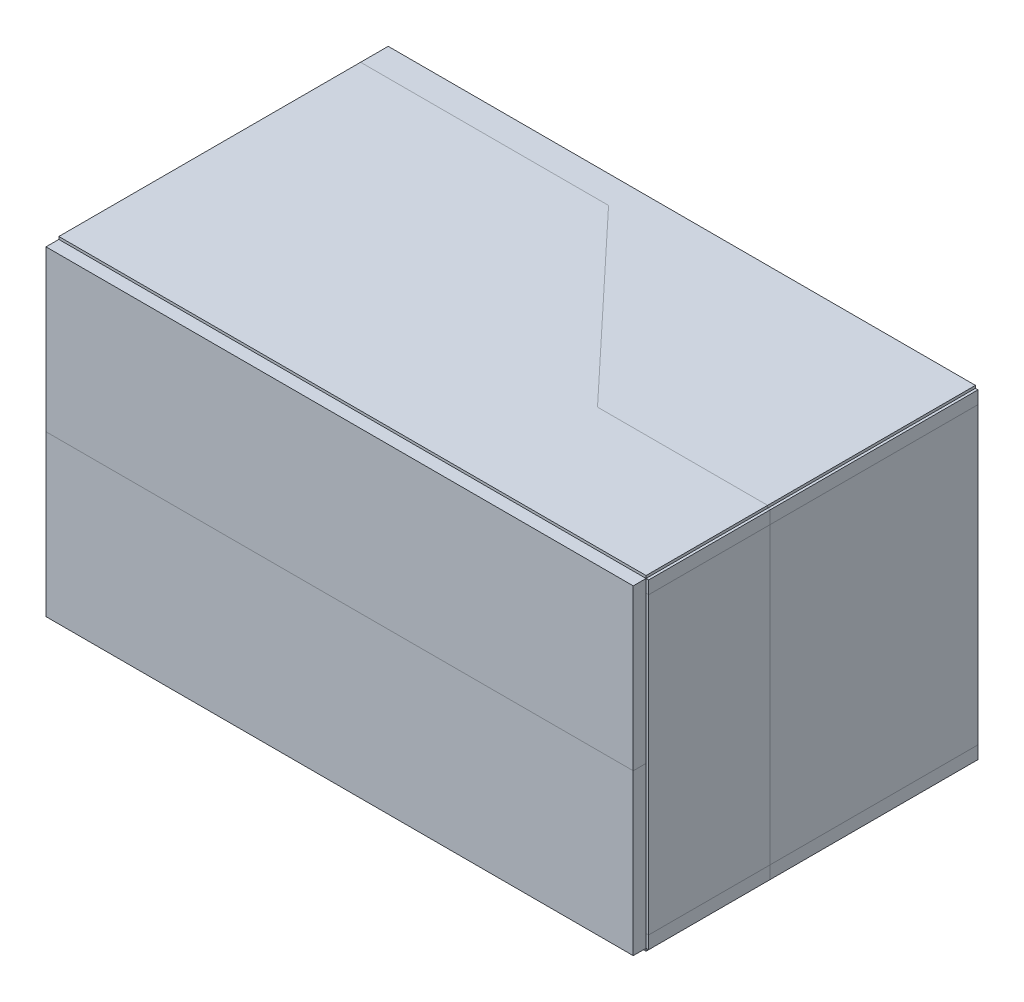
from build123d import *

# Parameters (mm, degrees)
SKETCH_1_W          = 229
SKETCH_1_H          = 124.895981316
EXTRUDE_1_DEPTH     = 7.860636733
SKETCH_2_W          = 229
SKETCH_2_H          = 5
CUT_EXTRUDE_1_DEPTH = 7.860636733
SKETCH_4_W          = 229
SKETCH_4_H          = 5
CUT_EXTRUDE_2_DEPTH = 7.860636733
SKETCH_5_W          = 5
SKETCH_5_H          = 114.895981316
CUT_EXTRUDE_3_DEPTH = 7.860636733
SKETCH_6_W          = 229
SKETCH_6_H          = 128.442125646
EXTRUDE_3_DEPTH     = 5
SKETCH_7_W          = 5
SKETCH_7_H          = 114.895981316
EXTRUDE_4_DEPTH     = 120.581488912
SKETCH_8_W          = 229
SKETCH_8_H          = 128.442125646
EXTRUDE_5_DEPTH     = 5
SKETCH_9_W          = 229
SKETCH_9_H          = 62.45
EXTRUDE_6_DEPTH     = 5
SKETCH_10_W         = 229
SKETCH_10_H         = 62.445981316
EXTRUDE_7_DEPTH     = 5
SKETCH_11_W         = 128.442125646
SKETCH_11_H         = 114.895981316
EXTRUDE_8_DEPTH     = 5
EXTRUDE_9_DEPTH     = 1
EXTRUDE_10_DEPTH    = 1
SKETCH_14_W         = 47.406489423
SKETCH_14_H         = 5
EXTRUDE_11_DEPTH    = 1
SKETCH_15_W         = 81.035636223
SKETCH_15_H         = 5
EXTRUDE_12_DEPTH    = 1
SKETCH_16_W         = 47.406489423
SKETCH_16_H         = 114.895981316
EXTRUDE_13_DEPTH    = 1
SKETCH_17_W         = 81.035636223
SKETCH_17_H         = 114.895981316
EXTRUDE_14_DEPTH    = 1
SKETCH_18_W         = 53.126978482
SKETCH_18_H         = 23.043618666
EXTRUDE_15_DEPTH    = 20
SKETCH_18_W_2       = 40.390239825
EXTRUDE_15_2_DEPTH  = 20
SKETCH_18_W_3       = 34.059537502
EXTRUDE_15_3_DEPTH  = 20
SKETCH_18_W_4       = 41.132707469
EXTRUDE_15_4_DEPTH  = 20
SKETCH_18_W_5       = 34.565287386
SKETCH_18_H_2       = 26.831202025
EXTRUDE_15_5_DEPTH  = 20
SKETCH_18_W_6       = 31.183641042
EXTRUDE_15_6_DEPTH  = 20
SKETCH_18_W_7       = 48.408890379
SKETCH_18_H_3       = 42.023668641
EXTRUDE_15_7_DEPTH  = 20
SKETCH_18_W_8       = 10.097559957
SKETCH_18_H_4       = 12.02797583
EXTRUDE_15_8_DEPTH  = 20
SKETCH_18_W_9       = 56.72452799
SKETCH_18_H_5       = 25.837874006
EXTRUDE_15_9_DEPTH  = 20
SKETCH_18_W_10      = 70.946201934
SKETCH_18_H_6       = 24.501432247
EXTRUDE_15_10_DEPTH = 20
SKETCH_18_W_11      = 64.297697957
SKETCH_18_H_7       = 26.728835178
EXTRUDE_15_11_DEPTH = 20
SKETCH_18_W_12      = 75.583206143
SKETCH_18_H_8       = 13.809898175
EXTRUDE_15_12_DEPTH = 20
SKETCH_18_W_13      = 64.000710899
SKETCH_18_H_9       = 34.302005145
EXTRUDE_15_13_DEPTH = 20
SKETCH_18_W_14      = 22.868003431
SKETCH_18_H_10      = 13.661404647
EXTRUDE_15_14_DEPTH = 20
SKETCH_18_W_15      = 24.204445189
SKETCH_18_H_11      = 11.582495244
EXTRUDE_15_15_DEPTH = 20
SKETCH_19_W         = 41.559774858
SKETCH_19_H         = 32.537902024
EXTRUDE_16_DEPTH    = 20
SKETCH_19_W_2       = 56.053931213
SKETCH_19_H_2       = 25.586622955
EXTRUDE_16_2_DEPTH  = 20
SKETCH_19_W_3       = 20.705937651
SKETCH_19_H_3       = 41.559774857
EXTRUDE_16_3_DEPTH  = 20
SKETCH_19_W_4       = 47.52357196
SKETCH_19_H_4       = 34.164797125
EXTRUDE_16_4_DEPTH  = 20
SKETCH_19_W_5       = 66.702699149
SKETCH_19_H_5       = 32.833701134
EXTRUDE_16_5_DEPTH  = 20
SKETCH_19_W_6       = 41.116076194
SKETCH_19_H_6       = 47.179957935
EXTRUDE_16_6_DEPTH  = 20
SKETCH_19_W_7       = 56.941328542
SKETCH_19_H_7       = 53.983337449
EXTRUDE_16_7_DEPTH  = 20
SKETCH_19_W_8       = 68.62539336
SKETCH_19_H_8       = 26.962014566
EXTRUDE_16_8_DEPTH  = 20
SKETCH_20_W         = 45.290526275
SKETCH_20_H         = 45.142032745
EXTRUDE_17_DEPTH    = 30
SKETCH_20_W_2       = 59.545905036
SKETCH_20_H_2       = 52.269722127
EXTRUDE_17_2_DEPTH  = 30
SKETCH_20_W_3       = 54.497125058
SKETCH_20_H_3       = 28.065276937
EXTRUDE_17_3_DEPTH  = 30
SKETCH_20_W_4       = 23.164990488
SKETCH_20_H_4       = 57.466995634
EXTRUDE_17_4_DEPTH  = 30
SKETCH_20_W_5       = 55.833566817
SKETCH_20_H_5       = 37.42036925
EXTRUDE_17_5_DEPTH  = 30
SKETCH_20_W_6       = 53.754657414
SKETCH_20_H_6       = 43.508603929
EXTRUDE_17_6_DEPTH  = 30
SKETCH_20_W_7       = 19.898132855
SKETCH_20_H_7       = 64.297697957
EXTRUDE_17_7_DEPTH  = 30
SKETCH_20_W_8       = 23.758964603
SKETCH_20_H_8       = 62.664269141
EXTRUDE_17_8_DEPTH  = 30
SKETCH_20_W_9       = 29.550212225
SKETCH_20_H_9       = 31.33213457
EXTRUDE_17_9_DEPTH  = 30
SKETCH_21_W         = 24.501432247
SKETCH_21_H         = 25.837874006
EXTRUDE_18_DEPTH    = 30
SKETCH_21_W_2       = 35.638446905
SKETCH_21_H_2       = 33.559537501
EXTRUDE_18_2_DEPTH  = 30
SKETCH_21_W_3       = 43.211616871
SKETCH_21_H_3       = 31.035147513
EXTRUDE_18_3_DEPTH  = 30
SKETCH_21_W_4       = 40.835720412
SKETCH_21_H_4       = 43.063123343
EXTRUDE_18_4_DEPTH  = 30
SKETCH_21_W_5       = 47.07244862
SKETCH_21_H_5       = 20.195119913
EXTRUDE_18_5_DEPTH  = 30
SKETCH_21_W_6       = 38.756811008
SKETCH_21_H_6       = 46.775461563
EXTRUDE_18_6_DEPTH  = 30
SKETCH_21_W_7       = 55.982060345
SKETCH_21_H_7       = 32.520082801
EXTRUDE_18_7_DEPTH  = 30
SKETCH_22_W         = 20
SKETCH_22_H         = 80
EXTRUDE_19_DEPTH    = 20
FILLET_1_R          = 10
SKETCH_23_W         = 2
SKETCH_23_H         = 70
CUT_EXTRUDE_4_DEPTH = 15


with BuildPart() as part:
    # 스케치1 → 보스-돌출1 (new body)
    with BuildSketch(Plane.XY):
        with Locations((165.5, 12.447990658)):
            Rectangle(SKETCH_1_W, SKETCH_1_H)
    extrude(amount=EXTRUDE_1_DEPTH)

    # 스케치2 → 컷-돌출1 (cut)
    with BuildSketch(Plane.XY.offset(7.860636733)):
        with Locations((165.5, 72.395981316)):
            Rectangle(SKETCH_2_W, SKETCH_2_H)
    extrude(amount=-CUT_EXTRUDE_1_DEPTH, mode=Mode.SUBTRACT)

    # 스케치4 → 컷-돌출2 (cut)
    with BuildSketch(Plane.XY.offset(7.860636733)):
        with Locations((165.5, -47.5)):
            Rectangle(SKETCH_4_W, SKETCH_4_H)
    extrude(amount=-CUT_EXTRUDE_2_DEPTH, mode=Mode.SUBTRACT)

    # 스케치5 → 컷-돌출3 (cut)
    with BuildSketch(Plane.XY.offset(7.860636733)):
        with Locations((277.5, 12.447990658)):
            Rectangle(SKETCH_5_W, SKETCH_5_H)
    extrude(amount=-CUT_EXTRUDE_3_DEPTH, mode=Mode.SUBTRACT)


with BuildPart() as body_2:
    # 스케치6 → 보스-돌출3 (new body)
    with BuildSketch(Plane(origin=(0, 69.895981316, 0), x_dir=(1, 0, 0), z_dir=(0, 1, 0))):
        with Locations((165.5, -64.221062823)):
            Rectangle(SKETCH_6_W, SKETCH_6_H)
    extrude(amount=EXTRUDE_3_DEPTH)


with BuildPart() as body_3:
    # 스케치7 → 보스-돌출4 (new body)
    with BuildSketch(Plane.XY.offset(7.860636733)):
        with Locations((53.5, 12.447990658)):
            Rectangle(SKETCH_7_W, SKETCH_7_H)
    extrude(amount=EXTRUDE_4_DEPTH)


with BuildPart() as body_4:
    # 스케치8 → 보스-돌출5 (new body)
    with BuildSketch(Plane.XZ.offset(45)):
        with Locations((165.5, 64.221062823)):
            Rectangle(SKETCH_8_W, SKETCH_8_H)
    extrude(amount=EXTRUDE_5_DEPTH)


with BuildPart() as body_5:
    # 스케치9 → 보스-돌출6 (new body)
    with BuildSketch(Plane.XY.offset(128.442125646)):
        with Locations((165.5, 43.670981316)):
            Rectangle(SKETCH_9_W, SKETCH_9_H)
    extrude(amount=EXTRUDE_6_DEPTH)


with BuildPart() as body_6:
    # 스케치10 → 보스-돌출7 (new body)
    with BuildSketch(Plane.XY.offset(128.442125646)):
        with Locations((165.5, -18.777009342)):
            Rectangle(SKETCH_10_W, SKETCH_10_H)
    extrude(amount=EXTRUDE_7_DEPTH)


with BuildPart() as body_7:
    # 스케치11 → 보스-돌출8 (new body)
    with BuildSketch(Plane(origin=(275, 0, 0), x_dir=(0, 0, -1), z_dir=(1, 0, 0))):
        with Locations((-64.221062823, 12.447990658)):
            Rectangle(SKETCH_11_W, SKETCH_11_H)
    extrude(amount=EXTRUDE_8_DEPTH)


with BuildPart() as body_8:
    # 스케치12 → 보스-돌출9 (new body)
    with BuildSketch(Plane.XZ.offset(50)):
        Polygon((51, 10.771238208), (147.705868367, 10.771238208), (213.658520424, 81.035636223), (280, 81.035636223), (280, 0), (51, 0), align=None)
    extrude(amount=EXTRUDE_9_DEPTH)


with BuildPart() as body_9:
    # 스케치13 → 보스-돌출10 (new body)
    with BuildSketch(Plane.XZ.offset(50)):
        Polygon((51, 128.442125646), (51, 10.771238208), (147.705868367, 10.771238208), (213.658520424, 81.035636223), (280, 81.035636223), (280, 128.442125646), align=None)
    extrude(amount=EXTRUDE_10_DEPTH)


with BuildPart() as body_10:
    # 스케치14 → 보스-돌출11 (new body)
    with BuildSketch(Plane(origin=(280, 0, 0), x_dir=(0, 0, -1), z_dir=(1, 0, 0))):
        with Locations((-104.738880935, -47.5)):
            Rectangle(SKETCH_14_W, SKETCH_14_H)
    extrude(amount=EXTRUDE_11_DEPTH)


with BuildPart() as body_11:
    # 스케치15 → 보스-돌출12 (new body)
    with BuildSketch(Plane(origin=(280, 0, 0), x_dir=(0, 0, -1), z_dir=(1, 0, 0))):
        with Locations((-40.517818112, -47.5)):
            Rectangle(SKETCH_15_W, SKETCH_15_H)
    extrude(amount=EXTRUDE_12_DEPTH)


with BuildPart() as body_12:
    # 스케치16 → 보스-돌출13 (new body)
    with BuildSketch(Plane(origin=(280, 0, 0), x_dir=(0, 0, -1), z_dir=(1, 0, 0))):
        with Locations((-104.738880935, 12.447990658)):
            Rectangle(SKETCH_16_W, SKETCH_16_H)
    extrude(amount=EXTRUDE_13_DEPTH)


with BuildPart() as body_13:
    # 스케치17 → 보스-돌출14 (new body)
    with BuildSketch(Plane(origin=(280, 0, 0), x_dir=(0, 0, -1), z_dir=(1, 0, 0))):
        with Locations((-40.517818112, 12.447990658)):
            Rectangle(SKETCH_17_W, SKETCH_17_H)
    extrude(amount=EXTRUDE_14_DEPTH)


with BuildPart() as body_14:
    # 대칭 복사2: mirrored copy
    add(body_8.part.mirror(Plane.ZX.offset(12.445981316)))


with BuildPart() as body_15:
    # Mirror 2 2: mirrored copy
    add(body_9.part.mirror(Plane.ZX.offset(12.445981316)))


with BuildPart() as body_16:
    # Mirror 2 3: mirrored copy
    add(body_10.part.mirror(Plane.ZX.offset(12.445981316)))


with BuildPart() as body_17:
    # Mirror 2 4: mirrored copy
    add(body_11.part.mirror(Plane.ZX.offset(12.445981316)))


with BuildPart() as body_18:
    # 스케치18 → 보스-돌출15 (new body)
    with BuildSketch(Plane.XY.offset(7.860636733)):
        with Locations((82.563489241, 58.374171983)):
            Rectangle(SKETCH_18_W, SKETCH_18_H)
    extrude(amount=EXTRUDE_15_DEPTH)


with BuildPart() as body_19:
    # 스케치18 → Extrude 15 2 (new body)
    with BuildSketch(Plane.XY.offset(7.860636733)):
        with Locations((138.23171012, 58.374171983)):
            Rectangle(SKETCH_18_W_2, SKETCH_18_H)
    extrude(amount=EXTRUDE_15_2_DEPTH)


with BuildPart() as body_20:
    # 스케치18 → Extrude 15 3 (new body)
    with BuildSketch(Plane.XY.offset(7.860636733)):
        with Locations((182.529768751, 58.374171983)):
            Rectangle(SKETCH_18_W_3, SKETCH_18_H)
    extrude(amount=EXTRUDE_15_3_DEPTH)


with BuildPart() as body_21:
    # 스케치18 → Extrude 15 4 (new body)
    with BuildSketch(Plane.XY.offset(7.860636733)):
        with Locations((227.402074146, 58.374171983)):
            Rectangle(SKETCH_18_W_4, SKETCH_18_H)
    extrude(amount=EXTRUDE_15_4_DEPTH)


with BuildPart() as body_22:
    # 스케치18 → Extrude 15 5 (new body)
    with BuildSketch(Plane.XY.offset(7.860636733)):
        with Locations((73.282643693, 25.863591671)):
            Rectangle(SKETCH_18_W_5, SKETCH_18_H_2)
    extrude(amount=EXTRUDE_15_5_DEPTH)


with BuildPart() as body_23:
    # 스케치18 → Extrude 15 6 (new body)
    with BuildSketch(Plane.XY.offset(7.860636733)):
        with Locations((111.354381413, 25.863591671)):
            Rectangle(SKETCH_18_W_6, SKETCH_18_H_2)
    extrude(amount=EXTRUDE_15_6_DEPTH)


with BuildPart() as body_24:
    # 스케치18 → Extrude 15 7 (new body)
    with BuildSketch(Plane.XY.offset(7.860636733)):
        with Locations((160.06025885, 18.267358363)):
            Rectangle(SKETCH_18_W_7, SKETCH_18_H_3)
    extrude(amount=EXTRUDE_15_7_DEPTH)


with BuildPart() as body_25:
    # 스케치18 → Extrude 15 8 (new body)
    with BuildSketch(Plane.XY.offset(7.860636733)):
        with Locations((194.510757524, 33.265204768)):
            Rectangle(SKETCH_18_W_8, SKETCH_18_H_4)
    extrude(amount=EXTRUDE_15_8_DEPTH)


with BuildPart() as body_26:
    # 스케치18 → Extrude 15 9 (new body)
    with BuildSketch(Plane.XY.offset(7.860636733)):
        with Locations((235.197984406, 26.36025568)):
            Rectangle(SKETCH_18_W_9, SKETCH_18_H_5)
    extrude(amount=EXTRUDE_15_9_DEPTH)


with BuildPart() as body_27:
    # 스케치18 → Extrude 15 10 (new body)
    with BuildSketch(Plane.XY.offset(7.860636733)):
        with Locations((91.473100967, -8.312983287)):
            Rectangle(SKETCH_18_W_10, SKETCH_18_H_6)
    extrude(amount=EXTRUDE_15_10_DEPTH)


with BuildPart() as body_28:
    # 스케치18 → Extrude 15 11 (new body)
    with BuildSketch(Plane.XY.offset(7.860636733)):
        with Locations((162.361908546, -18.484790008)):
            Rectangle(SKETCH_18_W_11, SKETCH_18_H_7)
    extrude(amount=EXTRUDE_15_11_DEPTH)


with BuildPart() as body_29:
    # 스케치18 → Extrude 15 12 (new body)
    with BuildSketch(Plane.XY.offset(7.860636733)):
        with Locations((225.76864533, 4.160473129)):
            Rectangle(SKETCH_18_W_12, SKETCH_18_H_8)
    extrude(amount=EXTRUDE_15_12_DEPTH)


with BuildPart() as body_30:
    # 스케치18 → Extrude 15 13 (new body)
    with BuildSketch(Plane.XY.offset(7.860636733)):
        with Locations((231.559892952, -24.350284395)):
            Rectangle(SKETCH_18_W_13, SKETCH_18_H_9)
    extrude(amount=EXTRUDE_15_13_DEPTH)


with BuildPart() as body_31:
    # 스케치18 → Extrude 15 14 (new body)
    with BuildSketch(Plane.XY.offset(7.860636733)):
        with Locations((70.073180416, -34.670584644)):
            Rectangle(SKETCH_18_W_14, SKETCH_18_H_10)
    extrude(amount=EXTRUDE_15_14_DEPTH)


with BuildPart() as body_32:
    # 스케치18 → Extrude 15 15 (new body)
    with BuildSketch(Plane.XY.offset(7.860636733)):
        with Locations((109.349718775, -35.710039345)):
            Rectangle(SKETCH_18_W_15, SKETCH_18_H_11)
    extrude(amount=EXTRUDE_15_15_DEPTH)


with BuildPart() as body_33:
    # 스케치19 → 보스-돌출16 (new body)
    with BuildSketch(Plane.XY.offset(27.860636733)):
        with Locations((80.503365876, 50.388632092)):
            Rectangle(SKETCH_19_W, SKETCH_19_H)
    extrude(amount=EXTRUDE_16_DEPTH)


with BuildPart() as body_34:
    # 스케치19 → Extrude 16 2 (new body)
    with BuildSketch(Plane.XY.offset(27.860636733)):
        with Locations((135.817799317, 52.089476971)):
            Rectangle(SKETCH_19_W_2, SKETCH_19_H_2)
    extrude(amount=EXTRUDE_16_2_DEPTH)


with BuildPart() as body_35:
    # 스케치19 → Extrude 16 3 (new body)
    with BuildSketch(Plane.XY.offset(27.860636733)):
        with Locations((184.254903466, 42.919704583)):
            Rectangle(SKETCH_19_W_3, SKETCH_19_H_3)
    extrude(amount=EXTRUDE_16_3_DEPTH)


with BuildPart() as body_36:
    # 스케치19 → Extrude 16 4 (new body)
    with BuildSketch(Plane.XY.offset(27.860636733)):
        with Locations((230.597506391, 49.575184542)):
            Rectangle(SKETCH_19_W_4, SKETCH_19_H_4)
    extrude(amount=EXTRUDE_16_4_DEPTH)


with BuildPart() as body_37:
    # 스케치19 → Extrude 16 5 (new body)
    with BuildSketch(Plane.XY.offset(27.860636733)):
        with Locations((99.730307982, 9.568355008)):
            Rectangle(SKETCH_19_W_5, SKETCH_19_H_5)
    extrude(amount=EXTRUDE_16_5_DEPTH)


with BuildPart() as body_38:
    # 스케치19 → Extrude 16 6 (new body)
    with BuildSketch(Plane.XY.offset(27.860636733)):
        with Locations((169.169148891, -5.295550235)):
            Rectangle(SKETCH_19_W_6, SKETCH_19_H_6)
    extrude(amount=EXTRUDE_16_6_DEPTH)


with BuildPart() as body_39:
    # 스케치19 → Extrude 16 7 (new body)
    with BuildSketch(Plane.XY.offset(27.860636733)):
        with Locations((230.029815631, -5.887148454)):
            Rectangle(SKETCH_19_W_7, SKETCH_19_H_7)
    extrude(amount=EXTRUDE_16_7_DEPTH)


with BuildPart() as body_40:
    # 스케치19 → Extrude 16 8 (new body)
    with BuildSketch(Plane.XY.offset(27.860636733)):
        with Locations((98.768960876, -28.020279684)):
            Rectangle(SKETCH_19_W_8, SKETCH_19_H_8)
    extrude(amount=EXTRUDE_16_8_DEPTH)


with BuildPart() as body_41:
    # 스케치20 → 보스-돌출17 (new body)
    with BuildSketch(Plane.XY.offset(47.860636733)):
        with Locations((92.718443553, 33.933425648)):
            Rectangle(SKETCH_20_W, SKETCH_20_H)
    extrude(amount=EXTRUDE_17_DEPTH)


with BuildPart() as body_42:
    # 스케치20 → Extrude 17 2 (new body)
    with BuildSketch(Plane.XY.offset(47.860636733)):
        with Locations((150.779413301, 41.506595615)):
            Rectangle(SKETCH_20_W_2, SKETCH_20_H_2)
    extrude(amount=EXTRUDE_17_2_DEPTH)


with BuildPart() as body_43:
    # 스케치20 → Extrude 17 3 (new body)
    with BuildSketch(Plane.XY.offset(47.860636733)):
        with Locations((213.443682442, 53.60881821)):
            Rectangle(SKETCH_20_W_3, SKETCH_20_H_3)
    extrude(amount=EXTRUDE_17_3_DEPTH)


with BuildPart() as body_44:
    # 스케치20 → Extrude 17 4 (new body)
    with BuildSketch(Plane.XY.offset(47.860636733)):
        with Locations((257.472013721, 38.907958861)):
            Rectangle(SKETCH_20_W_4, SKETCH_20_H_4)
    extrude(amount=EXTRUDE_17_4_DEPTH)


with BuildPart() as body_45:
    # 스케치20 → Extrude 17 5 (new body)
    with BuildSketch(Plane.XY.offset(47.860636733)):
        with Locations((89.525832685, -16.554374134)):
            Rectangle(SKETCH_20_W_5, SKETCH_20_H_5)
    extrude(amount=EXTRUDE_17_5_DEPTH)


with BuildPart() as body_46:
    # 스케치20 → Extrude 17 6 (new body)
    with BuildSketch(Plane.XY.offset(47.860636733)):
        with Locations((149.962698893, -14.846698553)):
            Rectangle(SKETCH_20_W_6, SKETCH_20_H_6)
    extrude(amount=EXTRUDE_17_6_DEPTH)


with BuildPart() as body_47:
    # 스케치20 → Extrude 17 7 (new body)
    with BuildSketch(Plane.XY.offset(47.860636733)):
        with Locations((194.213770467, -3.115709781)):
            Rectangle(SKETCH_20_W_7, SKETCH_20_H_7)
    extrude(amount=EXTRUDE_17_7_DEPTH)


with BuildPart() as body_48:
    # 스케치20 → Extrude 17 8 (new body)
    with BuildSketch(Plane.XY.offset(47.860636733)):
        with Locations((224.060969749, -5.268865947)):
            Rectangle(SKETCH_20_W_8, SKETCH_20_H_8)
    extrude(amount=EXTRUDE_17_8_DEPTH)


with BuildPart() as body_49:
    # 스케치20 → Extrude 17 9 (new body)
    with BuildSketch(Plane.XY.offset(47.860636733)):
        with Locations((257.991741073, -20.934933233)):
            Rectangle(SKETCH_20_W_9, SKETCH_20_H_9)
    extrude(amount=EXTRUDE_17_9_DEPTH)


with BuildPart() as body_50:
    # 스케치21 → 보스-돌출18 (new body)
    with BuildSketch(Plane.XY.offset(77.860636733)):
        with Locations((70.889894824, 54.722519675)):
            Rectangle(SKETCH_21_W, SKETCH_21_H)
    extrude(amount=EXTRUDE_18_DEPTH)


with BuildPart() as body_51:
    # 스케치21 → Extrude 18 2 (new body)
    with BuildSketch(Plane.XY.offset(77.860636733)):
        with Locations((77.646350383, 12.698851034)):
            Rectangle(SKETCH_21_W_2, SKETCH_21_H_2)
    extrude(amount=EXTRUDE_18_2_DEPTH)


with BuildPart() as body_52:
    # 스케치21 → Extrude 18 3 (new body)
    with BuildSketch(Plane.XY.offset(77.860636733)):
        with Locations((115.289459926, 48.411544703)):
            Rectangle(SKETCH_21_W_3, SKETCH_21_H_3)
    extrude(amount=EXTRUDE_18_3_DEPTH)


with BuildPart() as body_53:
    # 스케치21 → Extrude 18 4 (new body)
    with BuildSketch(Plane.XY.offset(77.860636733)):
        with Locations((130.287306331, 1.710329904)):
            Rectangle(SKETCH_21_W_4, SKETCH_21_H_4)
    extrude(amount=EXTRUDE_18_4_DEPTH)


with BuildPart() as body_54:
    # 스케치21 → Extrude 18 5 (new body)
    with BuildSketch(Plane.XY.offset(77.860636733)):
        with Locations((82.17540301, -25.166998803)):
            Rectangle(SKETCH_21_W_5, SKETCH_21_H_5)
    extrude(amount=EXTRUDE_18_5_DEPTH)


with BuildPart() as body_55:
    # 스케치21 → Extrude 18 6 (new body)
    with BuildSketch(Plane.XY.offset(77.860636733)):
        with Locations((174.538377904, 36.086581815)):
            Rectangle(SKETCH_21_W_6, SKETCH_21_H_6)
    extrude(amount=EXTRUDE_18_6_DEPTH)


with BuildPart() as body_56:
    # 스케치21 → Extrude 18 7 (new body)
    with BuildSketch(Plane.XY.offset(77.860636733)):
        with Locations((234.678257056, 45.738661185)):
            Rectangle(SKETCH_21_W_7, SKETCH_21_H_7)
    extrude(amount=EXTRUDE_18_7_DEPTH)


with BuildPart() as body_57:
    # 스케치22 → 보스-돌출19 (new body)
    with BuildSketch(Plane(origin=(56, 0, 0), x_dir=(0, 0, -1), z_dir=(1, 0, 0))):
        with Locations((-118.442125646, 12.447990658)):
            Rectangle(SKETCH_22_W, SKETCH_22_H)
    extrude(amount=EXTRUDE_19_DEPTH)

    # 필렛1
    fillet_1_edges = [body_57.edges().sort_by_distance(p)[0] for p in [
        (76, 12.447990658, 108.442125646),
    ]]
    fillet(fillet_1_edges, radius=FILLET_1_R)

    # 스케치23 → 컷-돌출4 (cut)
    with BuildSketch(Plane.XY.offset(128.442125646)):
        with Locations((58.207758452, 12.447990658)):
            Rectangle(SKETCH_23_W, SKETCH_23_H)
        with Locations((61.207758452, 12.447990658)):
            Rectangle(SKETCH_23_W, SKETCH_23_H)
        with Locations((64.207758452, 12.447990658)):
            Rectangle(SKETCH_23_W, SKETCH_23_H)
        with Locations((67.207758452, 12.447990658)):
            Rectangle(SKETCH_23_W, SKETCH_23_H)
        with Locations((70.207758452, 12.447990658)):
            Rectangle(SKETCH_23_W, SKETCH_23_H)
    extrude(amount=-CUT_EXTRUDE_4_DEPTH, mode=Mode.SUBTRACT)


solid = Compound([part.part, body_2.part, body_3.part, body_4.part, body_5.part, body_6.part, body_7.part, body_8.part, body_9.part, body_10.part, body_11.part, body_12.part, body_13.part, body_14.part, body_15.part, body_16.part, body_17.part, body_18.part, body_19.part, body_20.part, body_21.part, body_22.part, body_23.part, body_24.part, body_25.part, body_26.part, body_27.part, body_28.part, body_29.part, body_30.part, body_31.part, body_32.part, body_33.part, body_34.part, body_35.part, body_36.part, body_37.part, body_38.part, body_39.part, body_40.part, body_41.part, body_42.part, body_43.part, body_44.part, body_45.part, body_46.part, body_47.part, body_48.part, body_49.part, body_50.part, body_51.part, body_52.part, body_53.part, body_54.part, body_55.part, body_56.part, body_57.part])
